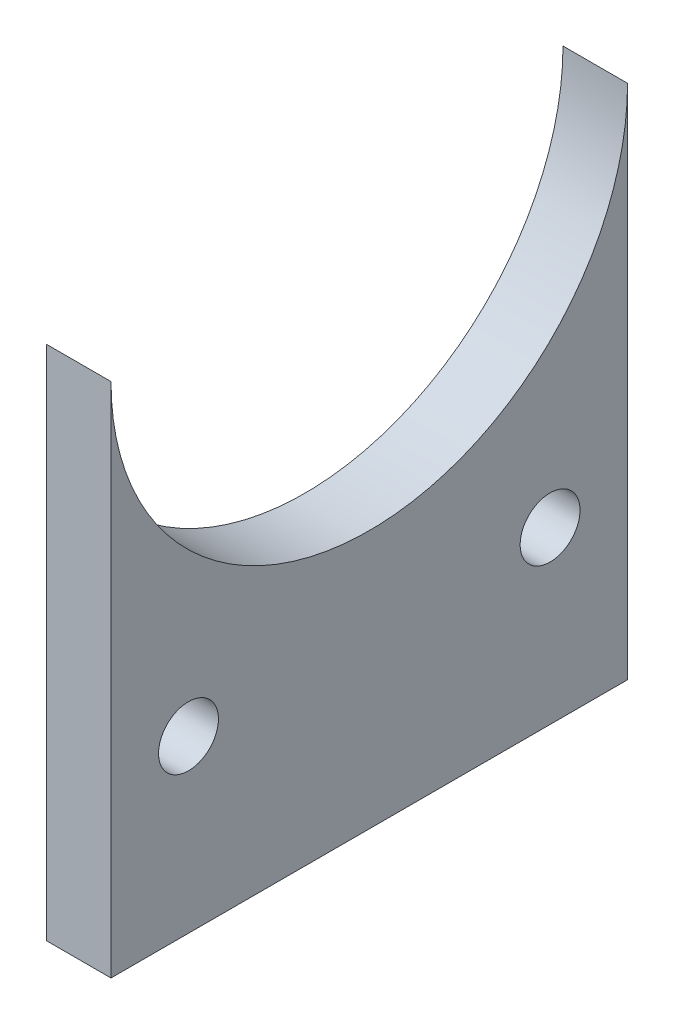
from build123d import *

# Parameters (mm, degrees)
BOSS_EXTRUDE1_DEPTH = 3.175
SKETCH6_R           = 1.473196931
CUT_EXTRUDE2_DEPTH  = 19.238986403


with BuildPart() as part:
    # Sketch1 → Boss-Extrude1 (new body)
    with BuildSketch(Plane(origin=(0, 0, 0), x_dir=(0, 0, -1), z_dir=(1, 0, 0))):
        with BuildLine():
            Line((-12.7, -12.7), (12.7, -12.7))
            Line((12.7, -12.7), (12.7, 12.7))
            ThreePointArc((12.7, 12.7), (0, 0), (-12.7, 12.7))
            Line((-12.7, 12.7), (-12.7, -12.7))
        make_face()
    extrude(amount=BOSS_EXTRUDE1_DEPTH)

    # Sketch6 → Cut-Extrude2 (cut, symmetric)
    with BuildSketch(Plane.ZY):
        with Locations((-8.889941847, -4.308950185)):
            Circle(SKETCH6_R)
    cut_extrude2 = extrude(amount=CUT_EXTRUDE2_DEPTH, both=True, mode=Mode.SUBTRACT)

    # Mirror2: Cut-Extrude2 across plane
    add(cut_extrude2.mirror(Plane.XY), mode=Mode.SUBTRACT)


solid = part.part
